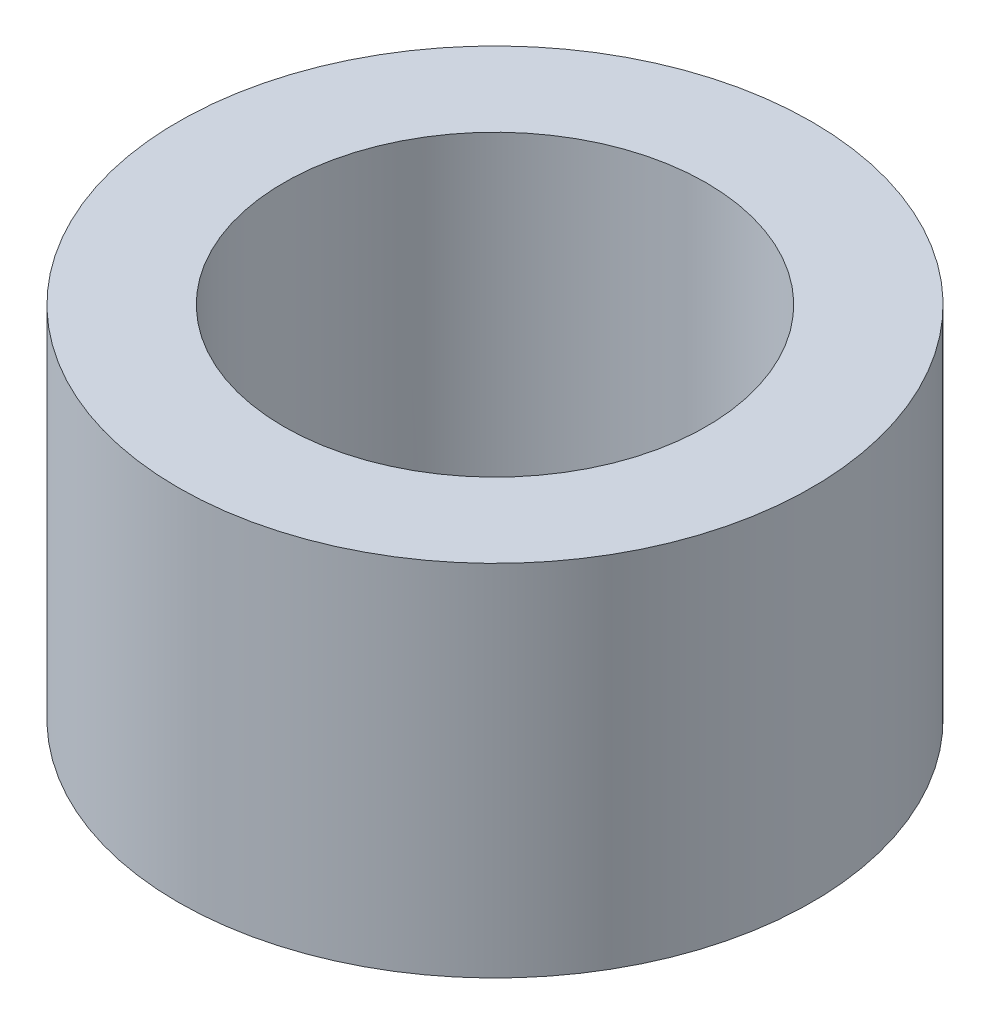
from build123d import *
from build123d.topology import SkipClean

# Parameters (mm, degrees)
SKETCH1_R           = 15
SKETCH1_R_2         = 10
BOSS_EXTRUDE1_DEPTH = 17
BOSS_EXTRUDE2_START = 2.5
SKETCH2_R           = 10.95
SKETCH2_R_2         = 10
BOSS_EXTRUDE2_DEPTH = 2.5


with BuildPart() as part:
    # Sketch1 → Boss-Extrude1 (new body)
    with BuildSketch(Plane(origin=(0, 0, 0), x_dir=(1, 0, 0), z_dir=(0, 1, 0))):
        with Locations(Location((0, 0, 0), (0, 0, 270))):
            Circle(SKETCH1_R)
        with Locations(Location((0, 0, 0), (0, 0, 270))):
            Circle(SKETCH1_R_2, mode=Mode.SUBTRACT)
    extrude(amount=BOSS_EXTRUDE1_DEPTH)

    # Sketch2 → Boss-Extrude2 (add)
    with SkipClean():  # the faces are left unmerged after this step: merging them gives an invalid solid
        with BuildSketch(Plane.XZ.offset(BOSS_EXTRUDE2_START)):
            with Locations(Location((0, 0, 0), (0, 0, 90))):
                Circle(SKETCH2_R)
            with Locations(Location((0, 0, 0), (0, 0, 270))):
                Circle(SKETCH2_R_2, mode=Mode.SUBTRACT)
        extrude(amount=-BOSS_EXTRUDE2_DEPTH)


solid = part.part
